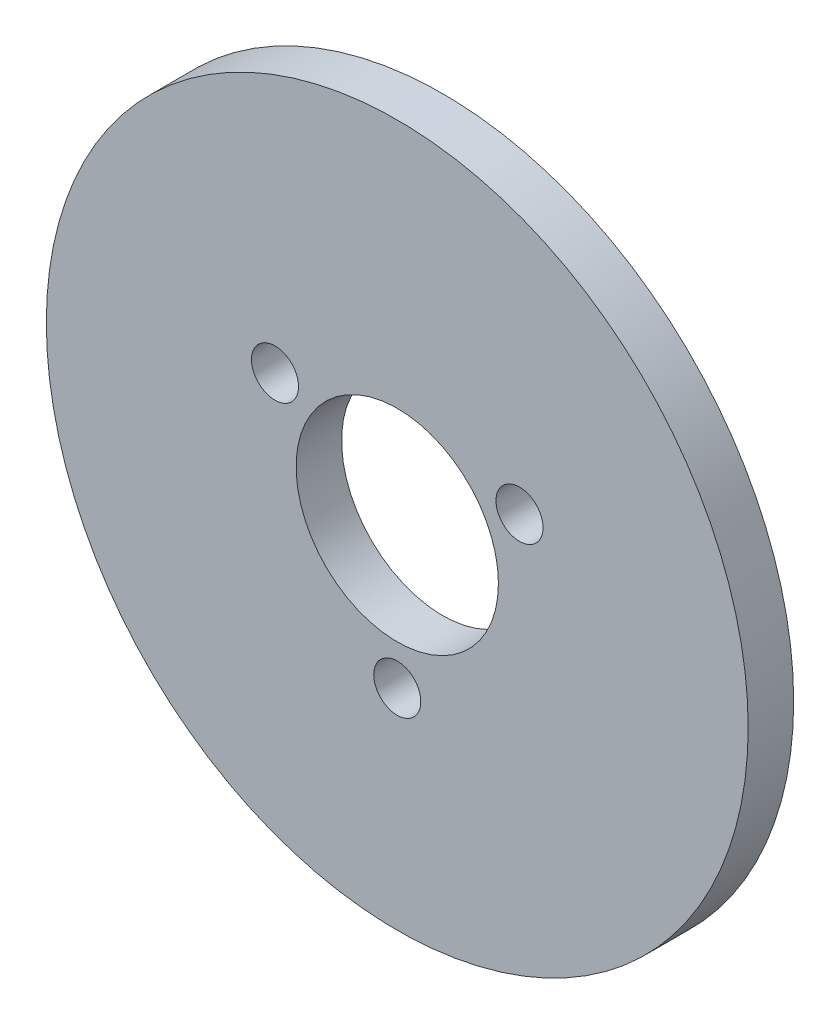
from build123d import *

# Parameters (mm, degrees)
SKETCH1_R           = 22.375
SKETCH1_R_2         = 6.45
BOSS_EXTRUDE1_DEPTH = 2.9
SKETCH2_R           = 1.5
CUT_EXTRUDE1_DEPTH  = 32.775639254


with BuildPart() as part:
    # Sketch1 → Boss-Extrude1 (new body)
    with BuildSketch(Plane.XY):
        Circle(SKETCH1_R)
        Circle(SKETCH1_R_2, mode=Mode.SUBTRACT)
    extrude(amount=BOSS_EXTRUDE1_DEPTH)

    # Sketch2 → Cut-Extrude1 (cut, through all)
    with BuildSketch(Plane(origin=(0, 0, 0), x_dir=(-1, 0, 0), z_dir=(0, 0, -1))):
        with Locations((7.794228634, 4.5)):
            Circle(SKETCH2_R)
        with Locations((-7.794228634, 4.5)):
            Circle(SKETCH2_R)
        with Locations((0, -9)):
            Circle(SKETCH2_R)
    extrude(amount=-CUT_EXTRUDE1_DEPTH, mode=Mode.SUBTRACT)


solid = part.part
